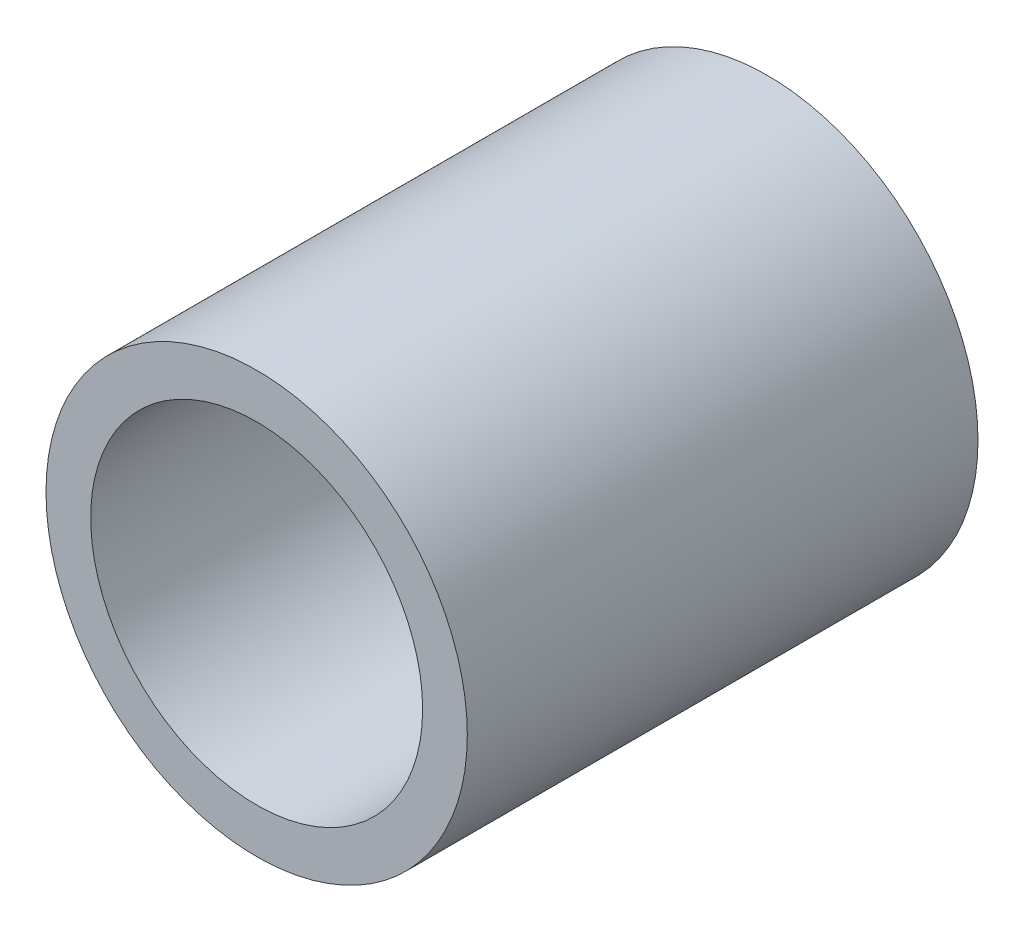
from build123d import *

# Parameters (mm, degrees)
SKETCH_1_R      = 3.3
SKETCH_1_R_2    = 2.6
EXTRUDE_1_DEPTH = 8


with BuildPart() as part:
    # 草图1 → 凸台-拉伸1 (new body)
    with BuildSketch(Plane.XY):
        Circle(SKETCH_1_R)
        Circle(SKETCH_1_R_2, mode=Mode.SUBTRACT)
    extrude(amount=EXTRUDE_1_DEPTH)


solid = part.part
